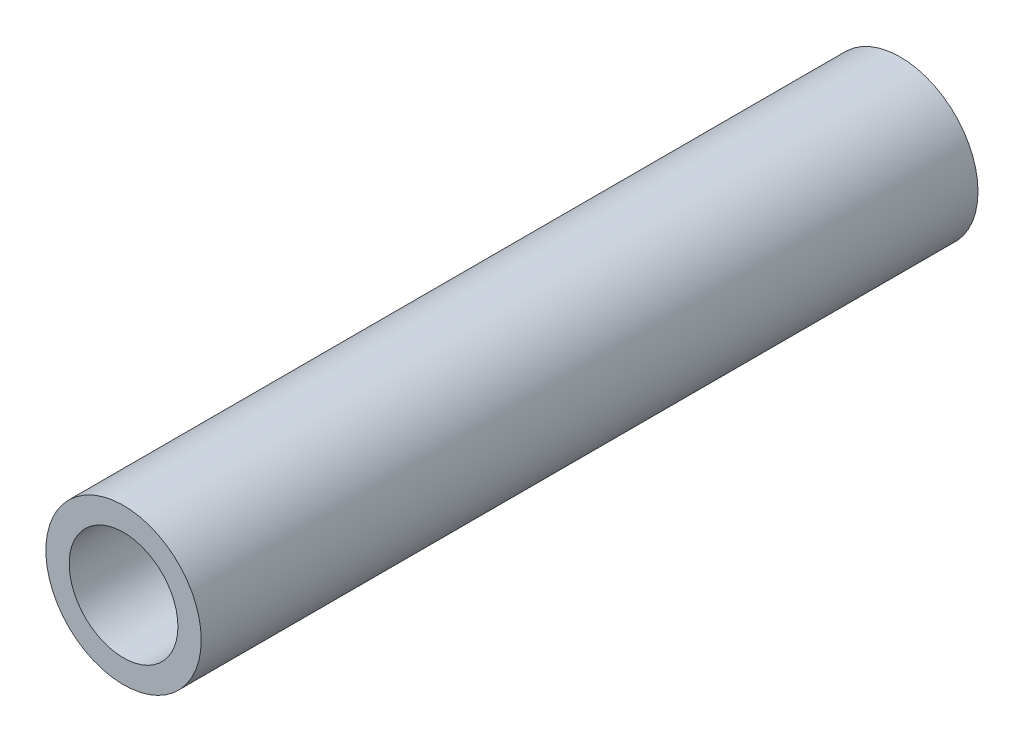
from build123d import *

# Parameters (mm, degrees)
SKETCH1_R           = 3
SKETCH1_R_2         = 2.1
BOSS_EXTRUDE1_DEPTH = 30


with BuildPart() as part:
    # Sketch1 → Boss-Extrude1 (new body)
    with BuildSketch(Plane.XY):
        Circle(SKETCH1_R)
        Circle(SKETCH1_R_2, mode=Mode.SUBTRACT)
    extrude(amount=BOSS_EXTRUDE1_DEPTH)


solid = part.part
